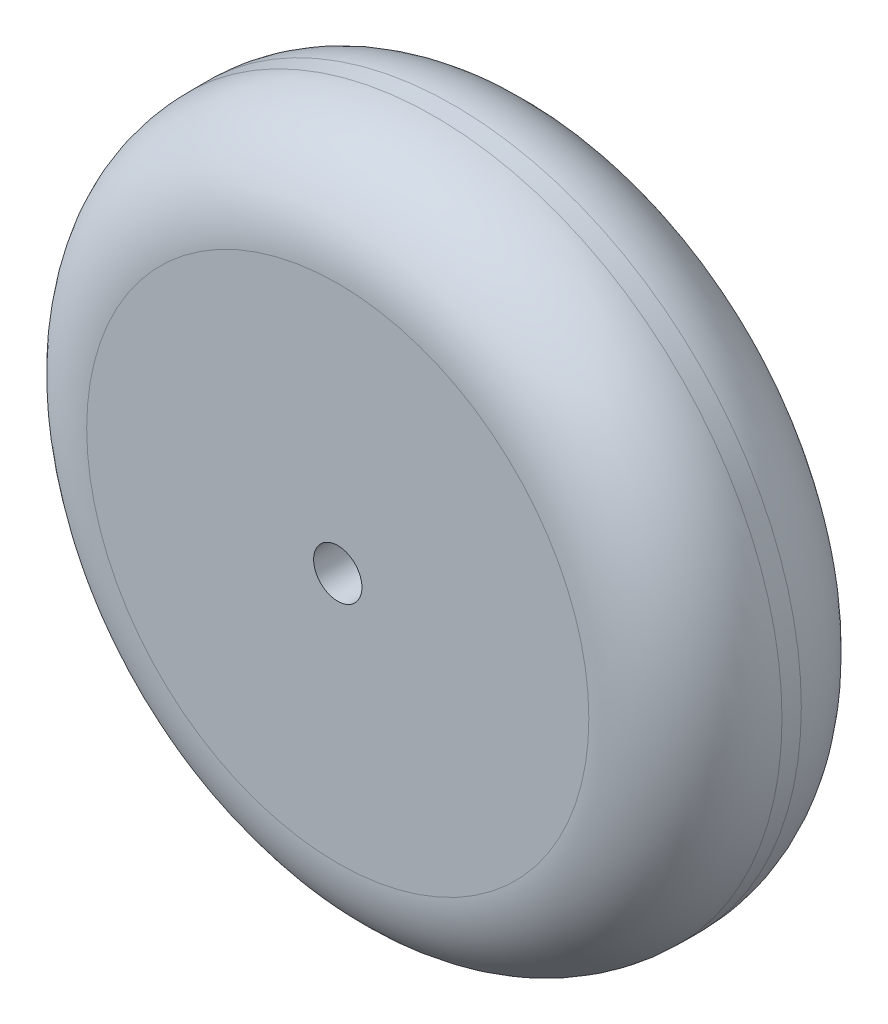
from build123d import *

# Parameters (mm, degrees)
SKETCH1_R        = 36
WHEEL_BASE_DEPTH = 22
SKETCH2_R        = 2.5
SHAFT_HOLE_DEPTH = 56.461698495
ROUNDING_R       = 10


with BuildPart() as part:
    # Sketch1 → Wheel-Base (new body)
    with BuildSketch(Plane.XY):
        Circle(SKETCH1_R)
    extrude(amount=WHEEL_BASE_DEPTH)

    # Sketch2 → Shaft-Hole (cut, through all)
    with BuildSketch(Plane.XY.offset(22)):
        Circle(SKETCH2_R)
    extrude(amount=-SHAFT_HOLE_DEPTH, mode=Mode.SUBTRACT)

    # Rounding
    rounding_edges = [part.edges().sort_by_distance(p)[0] for p in [
        (-36, 0, 0),
        (-36, 0, 22),
    ]]
    fillet(rounding_edges, radius=ROUNDING_R)


solid = part.part
